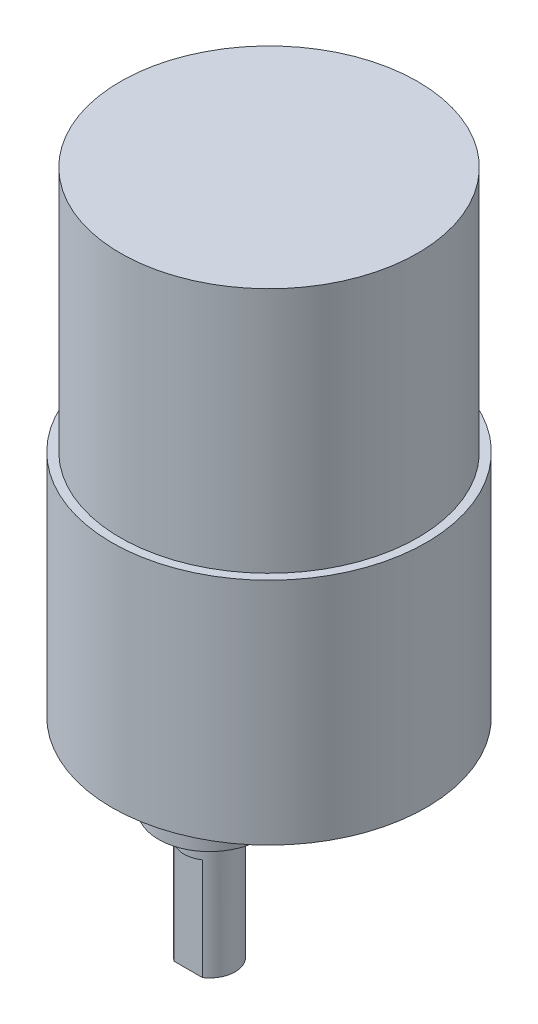
from build123d import *

# Parameters (mm, degrees)
SKIZZE1_R                       = 18.5
AUFSATZ_LINEAR_AUSTRAGEN1_DEPTH = 27
SKIZZE2_R                       = 17.5
AUFSATZ_LINEAR_AUSTRAGEN2_DEPTH = 29
SKIZZE3_R                       = 1.5
SCHNITT_LINEAR_AUSTRAGEN1_DEPTH = 10
SKIZZE4_R                       = 6
AUFSATZ_LINEAR_AUSTRAGEN3_DEPTH = 6
SKIZZE5_R                       = 3
AUFSATZ_LINEAR_AUSTRAGEN4_DEPTH = 15
SKIZZE6_W                       = 6
SKIZZE6_H                       = 1
SCHNITT_LINEAR_AUSTRAGEN2_DEPTH = 12


with BuildPart() as part:
    # Skizze1 → Aufsatz-Linear austragen1 (new body)
    with BuildSketch(Plane(origin=(0, 0, 0), x_dir=(1, 0, 0), z_dir=(0, 1, 0))):
        with Locations(Location((0, 0, 0), (0, 0, 270))):
            Circle(SKIZZE1_R)
    extrude(amount=AUFSATZ_LINEAR_AUSTRAGEN1_DEPTH)

    # Skizze2 → Aufsatz-Linear austragen2 (add)
    with BuildSketch(Plane(origin=(0, 27, 0), x_dir=(1, 0, 0), z_dir=(0, 1, 0))):
        with Locations(Location((0, 0, 0), (0, 0, 90))):
            Circle(SKIZZE2_R)
    extrude(amount=AUFSATZ_LINEAR_AUSTRAGEN2_DEPTH)

    # Skizze3 → Schnitt-Linear austragen1 (cut)
    with BuildSketch(Plane.XZ):
        with Locations(Location((-15.5, 0, 0), (0, 0, 270))):
            Circle(SKIZZE3_R)
        with Locations(Location((15.5, 0, 0), (0, 0, 270))):
            Circle(SKIZZE3_R)
        with Locations(Location((7.75, 13.423393759, 0), (0, 0, 270))):
            Circle(SKIZZE3_R)
        with Locations(Location((-7.75, 13.423393759, 0), (0, 0, 270))):
            Circle(SKIZZE3_R)
        with Locations(Location((-7.75, -13.423393759, 0), (0, 0, 270))):
            Circle(SKIZZE3_R)
        with Locations(Location((7.75, -13.423393759, 0), (0, 0, 270))):
            Circle(SKIZZE3_R)
    extrude(amount=-SCHNITT_LINEAR_AUSTRAGEN1_DEPTH, mode=Mode.SUBTRACT)

    # Skizze4 → Aufsatz-Linear austragen3 (add)
    with BuildSketch(Plane.XZ):
        with Locations(Location((0, 7, 0), (0, 0, 90))):
            Circle(SKIZZE4_R)
    extrude(amount=AUFSATZ_LINEAR_AUSTRAGEN3_DEPTH)

    # Skizze5 → Aufsatz-Linear austragen4 (add)
    with BuildSketch(Plane.XZ.offset(6)):
        with Locations(Location((0, 7, 0), (0, 0, 270))):
            Circle(SKIZZE5_R)
    extrude(amount=AUFSATZ_LINEAR_AUSTRAGEN4_DEPTH)

    # Skizze6 → Schnitt-Linear austragen2 (cut)
    with BuildSketch(Plane.XZ.offset(21)):
        with Locations((0, 10)):
            Rectangle(SKIZZE6_W, SKIZZE6_H)
    extrude(amount=-SCHNITT_LINEAR_AUSTRAGEN2_DEPTH, mode=Mode.SUBTRACT)


solid = part.part
